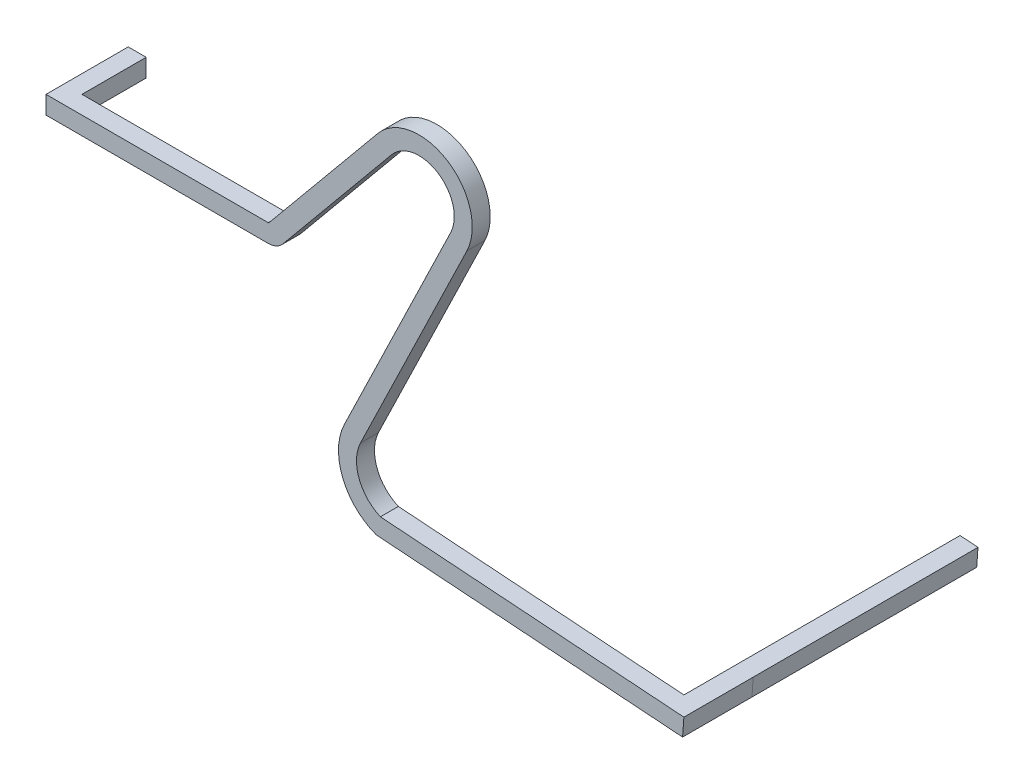
from build123d import *

# Parameters (mm, degrees)
Y_KSEKLIK_EKSTR_ZYON1_DEPTH = 2.8
IZIM2_W                     = 2.8
IZIM2_H                     = 2.8
Y_KSEKLIK_EKSTR_ZYON3_DEPTH = 45
Y_KSEKLIK_EKSTR_ZYON4_DEPTH = 8
IZIM4_W                     = 2.8
IZIM4_H                     = 2.803743846
KES_EKSTR_ZYON1_DEPTH       = 35
Y_KSEKLIK_EKSTR_ZYON5_DEPTH = 35


with BuildPart() as part:
    # Çizim1 → Yükseklik-Ekstrüzyon1 (new body)
    with BuildSketch(Plane.XY):
        with BuildLine():
            Line((0, 0), (34.587072671, 0))
            ThreePointArc((34.587072671, 0), (35.865324826, 0.285949258), (36.899900144, 1.089285714))
            Line((36.899900144, 1.089285714), (53.833333333, 21.586389745))
            ThreePointArc((53.833333333, 21.586389745), (61.045741484, 22.711143216), (63.022721024, 15.684376278))
            Line((63.022721024, 15.684376278), (46.447554388, -18.510124025))
            ThreePointArc((46.447554388, -18.510124025), (46.197115168, -25.807507473), (51.434005635, -30.895680351))
            Line((51.434005635, -30.895680351), (99.127590258, -34.315623722))
            Line((99.127590258, -34.315623722), (99.327854452, -31.522794645))
            Line((99.327854452, -31.522794645), (52.068910631, -28.134017876))
            ThreePointArc((52.068910631, -28.134017876), (48.729396862, -24.592999144), (48.967149147, -19.731452093))
            Line((48.967149147, -19.731452093), (65.542315784, 14.46304821))
            ThreePointArc((65.542315784, 14.46304821), (62.558873931, 25.067078316), (51.674694359, 23.369723078))
            Line((51.674694359, 23.369723078), (34.741261169, 2.872619048))
            ThreePointArc((34.741261169, 2.872619048), (34.672289482, 2.819063284), (34.587072671, 2.8))
            Line((34.587072671, 2.8), (0, 2.8))
            Line((0, 2.8), (0, 0))
        make_face()
    extrude(amount=Y_KSEKLIK_EKSTR_ZYON1_DEPTH)

    # Çizim2 → Yükseklik-Ekstrüzyon3 (add)
    with BuildSketch(Plane(origin=(0, 0, 0), x_dir=(-1, 0, 0), z_dir=(0, 0, -1))):
        with Locations((-1.4, 1.4)):
            Rectangle(IZIM2_W, IZIM2_H)
    extrude(amount=Y_KSEKLIK_EKSTR_ZYON3_DEPTH)

    # Çizim3 → Yükseklik-Ekstrüzyon4 (add)
    with BuildSketch(Plane(origin=(0, 0, 0), x_dir=(-1, 0, 0), z_dir=(0, 0, -1))):
        Polygon((-99.327854452, -31.522794645), (-99.127590258, -34.315623722), (-96.334761181, -34.115359528), (-96.535025375, -31.322530451), align=None)
    extrude(amount=Y_KSEKLIK_EKSTR_ZYON4_DEPTH)

    # Çizim4 → Kes-Ekstrüzyon1 (cut)
    with BuildSketch(Plane(origin=(0, 0, -45), x_dir=(-1, 0, 0), z_dir=(0, 0, -1))):
        with Locations((-1.4, 1.398128077)):
            Rectangle(IZIM4_W, IZIM4_H)
    extrude(amount=-KES_EKSTR_ZYON1_DEPTH, mode=Mode.SUBTRACT)

    # Çizim5 → Yükseklik-Ekstrüzyon5 (add)
    with BuildSketch(Plane(origin=(0, 0, -8), x_dir=(-1, 0, 0), z_dir=(0, 0, -1))):
        Polygon((-96.535025375, -31.322530451), (-96.334761181, -34.115359528), (-99.127284523, -34.315601799), (-99.327548717, -31.522772722), align=None)
    extrude(amount=Y_KSEKLIK_EKSTR_ZYON5_DEPTH)


solid = part.part
